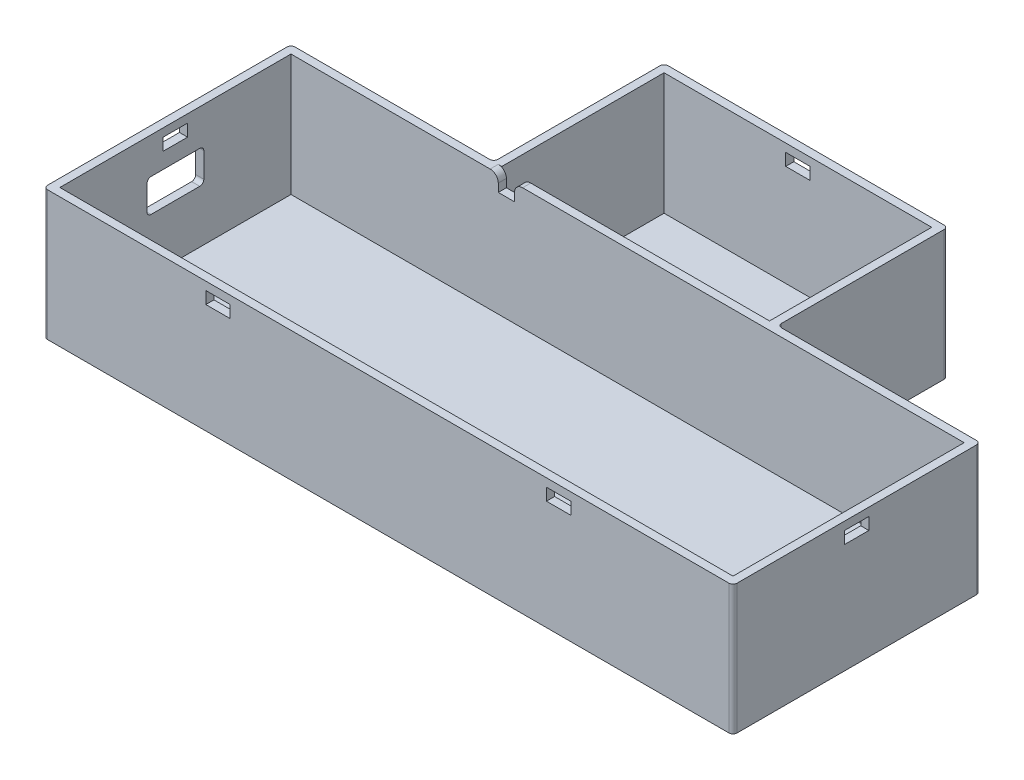
from build123d import *

# Parameters (mm, degrees)
SKETCH1_W           = 170
SKETCH1_H           = 61
BOSS_EXTRUDE1_DEPTH = 2
SKETCH2_W           = 170
SKETCH2_H           = 2
BOSS_EXTRUDE2_DEPTH = 17
SKETCH3_W           = 166
SKETCH3_H           = 2
BOSS_EXTRUDE3_DEPTH = 17
SKETCH4_W           = 70
SKETCH4_H           = 2
BOSS_EXTRUDE4_DEPTH = 42
SKETCH5_W           = 4
SKETCH5_H           = 8
CUT_EXTRUDE1_DEPTH  = 39
FILLET1_R           = 2
SKETCH6_W           = 2
SKETCH6_H           = 42
BOSS_EXTRUDE5_DEPTH = 17
SKETCH9_W           = 66
SKETCH9_H           = 2
BOSS_EXTRUDE6_DEPTH = 17
SKETCH10_W          = 6
SKETCH10_H          = 3
CUT_EXTRUDE2_DEPTH  = 10
SKETCH11_W          = 6
SKETCH11_H          = 3
CUT_EXTRUDE3_DEPTH  = 10
SKETCH12_W          = 6
SKETCH12_H          = 3
CUT_EXTRUDE4_DEPTH  = 10
SKETCH13_W          = 6
SKETCH13_H          = 3
CUT_EXTRUDE5_DEPTH  = 10
CUT_EXTRUDE6_DEPTH  = 2
SKETCH15_W          = 66
SKETCH15_H          = 40
SKETCH15_W_2        = 166
SKETCH15_H_2        = 57
BOSS_EXTRUDE7_DEPTH = 13
BOSS_EXTRUDE8_DEPTH = 2
SKETCH17_W          = 14
SKETCH17_H          = 8.1
CUT_EXTRUDE7_DEPTH  = 2
FILLET2_R           = 1
FILLET3_R           = 1


with BuildPart() as part:
    # Sketch1 → Boss-Extrude1 (new body)
    with BuildSketch(Plane(origin=(0, 0, 0), x_dir=(1, 0, 0), z_dir=(0, 1, 0))):
        with Locations((85, -30.5)):
            Rectangle(SKETCH1_W, SKETCH1_H)
    extrude(amount=BOSS_EXTRUDE1_DEPTH)

    # Sketch2 → Boss-Extrude2 (add)
    with BuildSketch(Plane(origin=(0, 2, 0), x_dir=(1, 0, 0), z_dir=(0, 1, 0))):
        with Locations((85, -1)):
            Rectangle(SKETCH2_W, SKETCH2_H)
    extrude(amount=BOSS_EXTRUDE2_DEPTH)

    # Sketch3 → Boss-Extrude3 (add)
    with BuildSketch(Plane(origin=(0, 2, 0), x_dir=(1, 0, 0), z_dir=(0, 1, 0))):
        Polygon((0, -2), (0, -61), (2, -61), (2, -59), (2, -2), align=None)
        Polygon((168, -59), (168, -61), (170, -61), (170, -2), (168, -2), align=None)
        with Locations((85, -60)):
            Rectangle(SKETCH3_W, SKETCH3_H)
    extrude(amount=BOSS_EXTRUDE3_DEPTH)

    # Sketch4 → Boss-Extrude4 (add)
    with BuildSketch(Plane(origin=(0, 0, 0), x_dir=(-1, 0, 0), z_dir=(0, 0, -1))):
        with Locations((-85, 1)):
            Rectangle(SKETCH4_W, SKETCH4_H)
    extrude(amount=BOSS_EXTRUDE4_DEPTH)

    # Sketch5 → Cut-Extrude1 (cut)
    with BuildSketch(Plane(origin=(0, 0, 0), x_dir=(-1, 0, 0), z_dir=(0, 0, -1))):
        with Locations((-55.116937283, 19)):
            Rectangle(SKETCH5_W, SKETCH5_H)
    extrude(amount=-CUT_EXTRUDE1_DEPTH, mode=Mode.SUBTRACT)

    # Fillet1
    fillet1_edges = [part.edges().sort_by_distance(p)[0] for p in [
        (53.116937283, 19, 1),
        (57.116937283, 19, 1),
    ]]
    fillet(fillet1_edges, radius=FILLET1_R)

    # Sketch6 → Boss-Extrude5 (add)
    with BuildSketch(Plane(origin=(0, 2, 0), x_dir=(1, 0, 0), z_dir=(0, 1, 0))):
        with Locations((119, 21)):
            Rectangle(SKETCH6_W, SKETCH6_H)
    extrude(amount=BOSS_EXTRUDE5_DEPTH)

    # Sketch9 → Boss-Extrude6 (add)
    with BuildSketch(Plane(origin=(0, 2, 0), x_dir=(1, 0, 0), z_dir=(0, 1, 0))):
        Polygon((52, 42), (50, 42), (50, 0), (52, 0), (52, 40), align=None)
        with Locations((85, 41)):
            Rectangle(SKETCH9_W, SKETCH9_H)
    extrude(amount=BOSS_EXTRUDE6_DEPTH)

    # Sketch10 → Cut-Extrude2 (cut)
    with BuildSketch(Plane.XY.offset(61)):
        with Locations((43, 15.5)):
            Rectangle(SKETCH10_W, SKETCH10_H)
        with Locations((127, 15.5)):
            Rectangle(SKETCH10_W, SKETCH10_H)
    extrude(amount=-CUT_EXTRUDE2_DEPTH, mode=Mode.SUBTRACT)

    # Sketch11 → Cut-Extrude3 (cut)
    with BuildSketch(Plane.ZY):
        with Locations((30.5, 15.5)):
            Rectangle(SKETCH11_W, SKETCH11_H)
    extrude(amount=-CUT_EXTRUDE3_DEPTH, mode=Mode.SUBTRACT)

    # Sketch12 → Cut-Extrude4 (cut)
    with BuildSketch(Plane(origin=(0, 0, -42), x_dir=(-1, 0, 0), z_dir=(0, 0, -1))):
        with Locations((-85, 15.5)):
            Rectangle(SKETCH12_W, SKETCH12_H)
    extrude(amount=-CUT_EXTRUDE4_DEPTH, mode=Mode.SUBTRACT)

    # Sketch13 → Cut-Extrude5 (cut)
    with BuildSketch(Plane(origin=(170, 0, 0), x_dir=(0, 0, -1), z_dir=(1, 0, 0))):
        with Locations((-30.5, 15.5)):
            Rectangle(SKETCH13_W, SKETCH13_H)
    extrude(amount=-CUT_EXTRUDE5_DEPTH, mode=Mode.SUBTRACT)

    # Sketch14 → Cut-Extrude6 (cut)
    with BuildSketch(Plane.XZ):
        Polygon((0, 61), (0, 0), (50, 0), (50, -42), (120, -42), (120, 0), (170, 0), (170, 61), align=None)
    extrude(amount=-CUT_EXTRUDE6_DEPTH, mode=Mode.SUBTRACT)

    # Sketch15 → Boss-Extrude7 (add)
    with BuildSketch(Plane.XZ.offset(-2)):
        Polygon((170, 61), (0, 61), (0, 0), (50, 0), (50, -42), (120, -42), (120, 0), (170, 0), align=None)
        with Locations((85, -20)):
            Rectangle(SKETCH15_W, SKETCH15_H, mode=Mode.SUBTRACT)
        with Locations((85, 30.5)):
            Rectangle(SKETCH15_W_2, SKETCH15_H_2, mode=Mode.SUBTRACT)
    extrude(amount=BOSS_EXTRUDE7_DEPTH)

    # Sketch16 → Boss-Extrude8 (add)
    with BuildSketch(Plane.XZ.offset(11)):
        Polygon((120, -42), (120, 0), (170, 0), (170, 61), (0, 61), (0, 0), (50, 0), (50, -42), align=None)
    extrude(amount=BOSS_EXTRUDE8_DEPTH)

    # Sketch17 → Cut-Extrude7 (cut)
    with BuildSketch(Plane.ZY):
        with Locations((30.5, 6.05)):
            Rectangle(SKETCH17_W, SKETCH17_H)
    extrude(amount=-CUT_EXTRUDE7_DEPTH, mode=Mode.SUBTRACT)

    # Fillet2
    fillet2_edges = [part.edges().sort_by_distance(p)[0] for p in [
        (50, 3, -42),
        (120, 3, -42),
        (120, 3, 0),
        (50, 3, 0),
        (0, 3, 0),
        (170, 3, 0),
        (170, 3, 61),
        (0, 3, 61),
    ]]
    fillet(fillet2_edges, radius=FILLET2_R)

    # Fillet3
    fillet3_edges = [part.edges().sort_by_distance(p)[0] for p in [
        (1, 2, 23.5),
        (1, 10.1, 23.5),
        (1, 10.1, 37.5),
        (1, 2, 37.5),
    ]]
    fillet(fillet3_edges, radius=FILLET3_R)


solid = part.part
